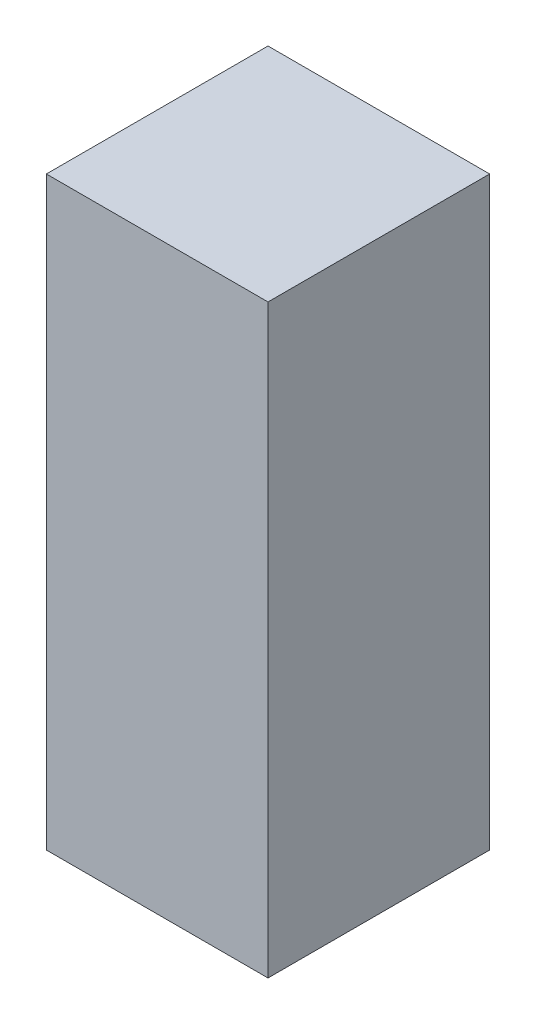
from build123d import *

# Parameters (mm, degrees)
SKETCH1_W           = 5.3
SKETCH1_H           = 5.3
BOSS_EXTRUDE1_DEPTH = 14


with BuildPart() as part:
    # Sketch1 → Boss-Extrude1 (new body)
    with BuildSketch(Plane(origin=(0, 0, 0), x_dir=(1, 0, 0), z_dir=(0, 1, 0))):
        Rectangle(SKETCH1_W, SKETCH1_H)
    extrude(amount=BOSS_EXTRUDE1_DEPTH)


solid = part.part
